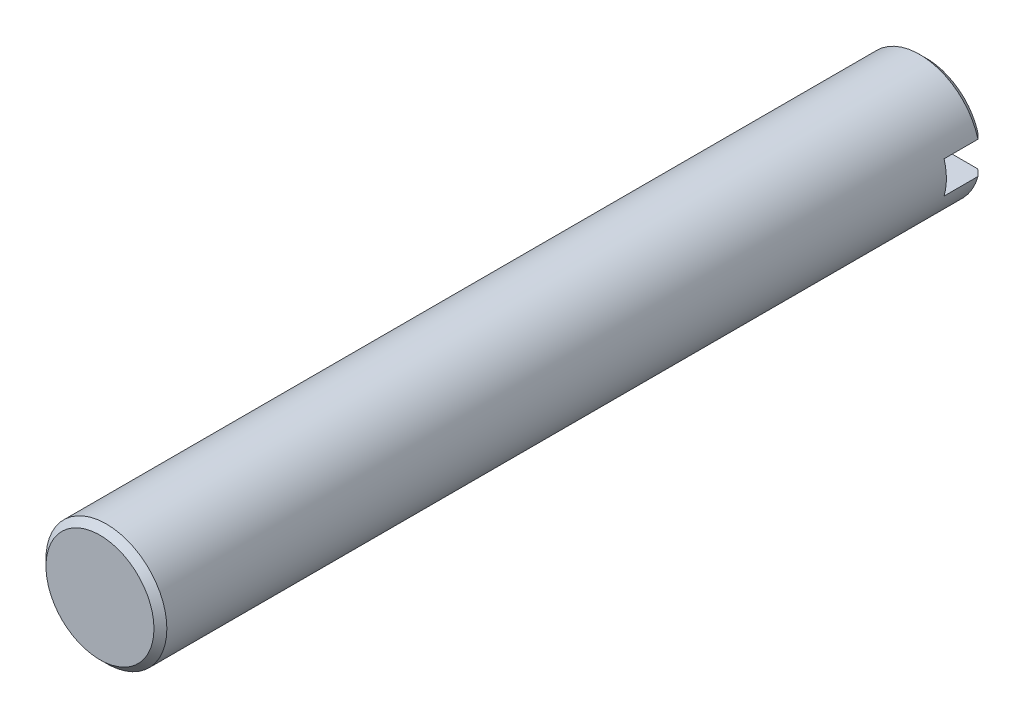
from build123d import *

# Parameters (mm, degrees)
SKETCH1_R           = 4.7625
BOSS_EXTRUDE2_DEPTH = 65.1002
SKETCH4_W           = 10.977658727
SKETCH4_H           = 2.54
CUT_EXTRUDE7_DEPTH  = 3.175
CHAMFER1_SIZE       = 0.508
CHAMFER2_SIZE       = 0.508
CHAMFER3_SIZE       = 0.508


with BuildPart() as part:
    # Sketch1 → Boss-Extrude2 (new body)
    with BuildSketch(Plane.XY):
        with Locations((-9.328114369, 3.252234469)):
            Circle(SKETCH1_R)
    extrude(amount=BOSS_EXTRUDE2_DEPTH)

    # Sketch4 → Cut-Extrude7 (cut)
    with BuildSketch(Plane(origin=(0, 0, 0), x_dir=(-1, 0, 0), z_dir=(0, 0, -1))):
        with Locations((9.328114369, 3.252234469)):
            Rectangle(SKETCH4_W, SKETCH4_H)
    extrude(amount=-CUT_EXTRUDE7_DEPTH, mode=Mode.SUBTRACT)

    # Chamfer1
    chamfer1_edges = [part.edges().sort_by_distance(p)[0] for p in [
        (-9.328114369, 8.014734469, 0),
    ]]
    chamfer(chamfer1_edges, length=CHAMFER1_SIZE)

    # Chamfer2
    chamfer2_edges = [part.edges().sort_by_distance(p)[0] for p in [
        (-9.328114369, -1.510265531, 0),
    ]]
    chamfer(chamfer2_edges, length=CHAMFER2_SIZE)

    # Chamfer3
    chamfer3_edges = [part.edges().sort_by_distance(p)[0] for p in [
        (-14.090614369, 3.252234469, 65.1002),
    ]]
    chamfer(chamfer3_edges, length=CHAMFER3_SIZE)


solid = part.part
